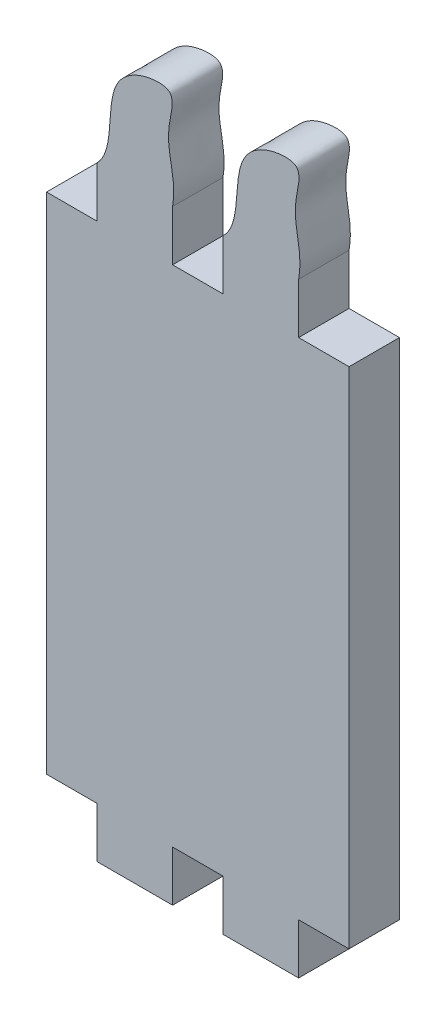
from build123d import *

# Parameters (mm, degrees)
SKETCH1_W           = 4.7625
SKETCH1_H           = 3.175
SKETCH1_R           = 2.38125
BOSS_EXTRUDE1_DEPTH = 3.175
SKETCH2_W           = 18.153868455
SKETCH2_H           = 36.5466036
CUT_EXTRUDE1_DEPTH  = 37.051048247


with BuildPart() as part:
    # Sketch1 → Boss-Extrude1 (new body)
    # profile 1 of 9: a face of its own
    with BuildSketch(Plane.XY):
        Polygon((6.35, -15.875), (9.525, -15.875), (9.525, 15.875), (6.35, 15.875), (1.5875, 15.875), (-1.5875, 15.875), (-6.35, 15.875), (-9.525, 15.875), (-9.525, -15.875), (-6.35, -15.875), (-1.5875, -15.875), (1.5875, -15.875), align=None)
    # profile 2 of 9: a face of its own
    with BuildSketch(Plane.XY):
        with Locations((3.96875, -17.4625)):
            Rectangle(SKETCH1_W, SKETCH1_H)
    # profile 3 of 9: a face of its own
    with BuildSketch(Plane.XY):
        with Locations((3.96875, 17.4625)):
            Rectangle(SKETCH1_W, SKETCH1_H)
    # profile 4 of 9: a face of its own
    with BuildSketch(Plane.XY):
        with Locations((-3.96875, -17.4625)):
            Rectangle(SKETCH1_W, SKETCH1_H)
    # profile 5 of 9: a face of its own
    with BuildSketch(Plane.XY):
        with BuildLine():
            Line((1.5875, 19.05), (6.35, 19.05))
            add(Edge.make_bspline(
                [(1.5875, 19.05), (2.876060697, 20.282977256), (1.750876168, 23.717010334), (4.480105354, 25.343943309), (6.713969799, 25.323271855), (5.664629716, 22.075566326), (6.66156491, 20.85876393), (6.35, 19.05)],
                knots=[0, 0, 0, 0, 0.347503902, 0.512635707, 0.589513021, 0.712232462, 1, 1, 1, 1], degree=3))
        make_face()
    # profile 6 of 9: a face of its own
    with BuildSketch(Plane.XY):
        with Locations((-3.96875, 17.4625)):
            Rectangle(SKETCH1_W, SKETCH1_H)
    # profile 7 of 9: a face of its own
    with BuildSketch(Plane.XY):
        with BuildLine():
            add(Edge.make_bspline(
                [(-21.547594304, -5.838195157), (-17.741398311, -7.466495201), (-15.030939304, -8.836500628), (-13.009281216, -15.917091584), (-9.525, -15.875)],
                knots=[0, 0, 0, 0, 0.458191309, 1, 1, 1, 1], degree=3))
            Line((-9.525, -15.875), (-9.525, 15.875))
            add(Edge.make_bspline(
                [(-21.547594304, 5.838195157), (-17.741398311, 7.466495201), (-15.030939304, 8.836500628), (-13.009281216, 15.917091584), (-9.525, 15.875)],
                knots=[0, 0, 0, 0, 0.458191309, 1, 1, 1, 1], degree=3))
            ThreePointArc((-21.547594304, 5.838195157), (-15.552659856, 5.300104896), (-12.7, 0))
            ThreePointArc((-12.7, 0), (-15.552659856, -5.300104896), (-21.547594304, -5.838195157))
        make_face()
    # profile 8 of 9: a face of its own
    with BuildSketch(Plane.XY):
        with BuildLine():
            Line((-6.35, 19.05), (-1.5875, 19.05))
            add(Edge.make_bspline(
                [(-6.35, 19.05), (-5.108948033, 20.312838142), (-6.248797567, 23.782627537), (-3.504668245, 25.422749175), (-1.270595434, 25.401850486), (-2.33046195, 22.118193687), (-1.30296019, 20.902293296), (-1.5875, 19.05)],
                knots=[0, 0, 0, 0, 0.348300856, 0.511853831, 0.587996117, 0.709542233, 1, 1, 1, 1], degree=3))
        make_face()
    # profile 9 of 9: a face of its own
    with BuildSketch(Plane.XY):
        with BuildLine():
            ThreePointArc((-21.547594304, 5.838195157), (-25.4, 0), (-21.547594304, -5.838195157))
            ThreePointArc((-21.547594304, -5.838195157), (-15.552659856, -5.300104896), (-12.7, 0))
            ThreePointArc((-12.7, 0), (-15.552659856, 5.300104896), (-21.547594304, 5.838195157))
        make_face()
        with Locations((-19.05, 0)):
            Circle(SKETCH1_R, mode=Mode.SUBTRACT)
    extrude(amount=BOSS_EXTRUDE1_DEPTH)

    # Sketch2 → Cut-Extrude1 (cut, through all)
    with BuildSketch(Plane.XY.offset(3.175)):
        with Locations((-18.601934228, -1.387664621)):
            Rectangle(SKETCH2_W, SKETCH2_H)
    extrude(amount=-CUT_EXTRUDE1_DEPTH, mode=Mode.SUBTRACT)


solid = part.part
